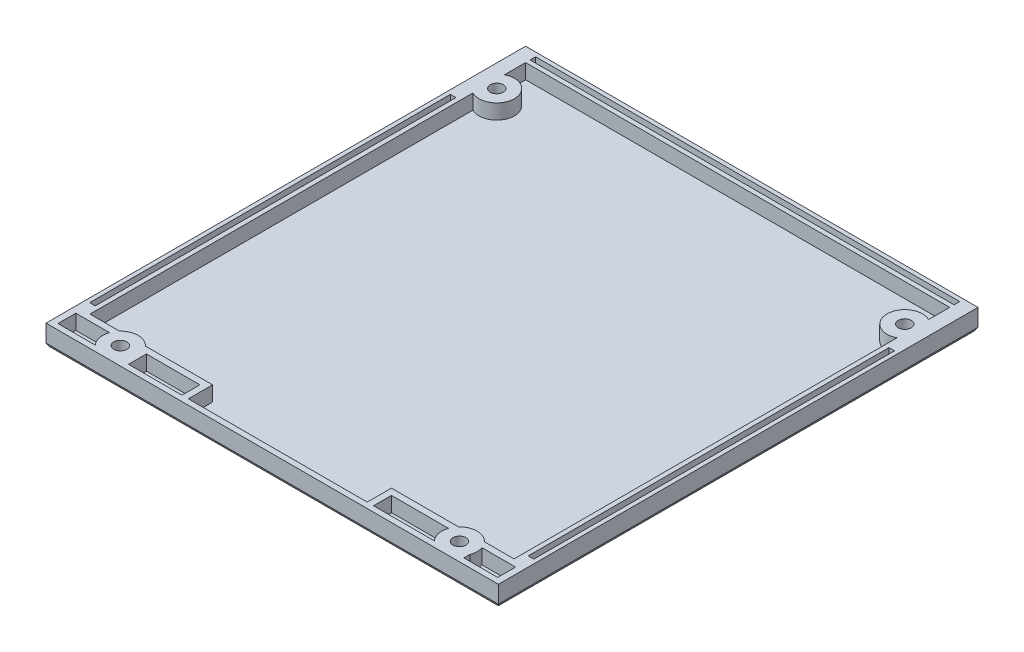
from build123d import *

# Parameters (mm, degrees)
SKETCH_1_W          = 121.4
SKETCH_1_H          = 128.7
EXTRUDE_1_DEPTH     = 1.5
EXTRUDE_2_DEPTH     = 2
SKETCH_3_W          = 1.5
SKETCH_3_H          = 96.8
SKETCH_3_W_2        = 113.8
SKETCH_3_H_2        = 1.5
EXTRUDE_3_DEPTH     = 2
SKETCH_5_W          = 121.4
SKETCH_5_H          = 8
SKETCH_5_W_2        = 12.45
SKETCH_5_H_2        = 4.8
SKETCH_5_W_3        = 9.05
SKETCH_5_W_4        = 17.75
SKETCH_5_W_5        = 14.35
SKETCH_5_W_6        = 48
EXTRUDE_5_DEPTH     = 4
SKETCH_7_R          = 4.75
EXTRUDE_10_DEPTH    = 4
SKETCH_8_R          = 1.75
CUT_EXTRUDE_3_DEPTH = 5.5
CHAMFER_1_SIZE      = 1.6
SKETCH_10_W         = 48
SKETCH_10_H         = 6.5
CUT_EXTRUDE_4_DEPTH = 4
CHAMFER_2_SIZE      = 0.5
CHAMFER_2_SIZE2     = 0.866025404


with BuildPart() as part:
    # Эскиз1 → Бобышка-Вытянуть1 (new body)
    with BuildSketch(Plane(origin=(0, 0, 0), x_dir=(1, 0, 0), z_dir=(0, 1, 0))):
        with Locations((60.7, 64.35)):
            Rectangle(SKETCH_1_W, SKETCH_1_H)
    extrude(amount=EXTRUDE_1_DEPTH)

    # Эскиз2 → Бобышка-Вытянуть2 (add)
    with BuildSketch(Plane(origin=(0, 1.5, 0), x_dir=(1, 0, 0), z_dir=(0, 1, 0))):
        Polygon((0, 8), (0, 128.7), (121.4, 128.7), (121.4, 8), (117.6, 8), (117.6, 124.9), (3.8, 124.9), (3.8, 8), align=None)
    extrude(amount=EXTRUDE_2_DEPTH)

    # Эскиз3 → Бобышка-Вытянуть3 (add)
    with BuildSketch(Plane(origin=(0, 3.5, 0), x_dir=(1, 0, 0), z_dir=(0, 1, 0))):
        Polygon((0, 8), (3.8, 8), (3.8, 124.9), (117.6, 124.9), (117.6, 8), (121.4, 8), (121.4, 128.7), (0, 128.7), align=None)
        with Locations((1.85, 59)):
            Rectangle(SKETCH_3_W, SKETCH_3_H, mode=Mode.SUBTRACT)
        with Locations((60.7, 126.85)):
            Rectangle(SKETCH_3_W_2, SKETCH_3_H_2, mode=Mode.SUBTRACT)
        with Locations((119.55, 59)):
            Rectangle(SKETCH_3_W, SKETCH_3_H, mode=Mode.SUBTRACT)
    extrude(amount=EXTRUDE_3_DEPTH)

    # Эскиз5 → Бобышка-Вытянуть5 (add)
    with BuildSketch(Plane(origin=(0, 1.5, 0), x_dir=(1, 0, 0), z_dir=(0, 1, 0))):
        with Locations((60.7, 4)):
            Rectangle(SKETCH_5_W, SKETCH_5_H)
        with Locations((7.925, 3.9)):
            Rectangle(SKETCH_5_W_2, SKETCH_5_H_2, mode=Mode.SUBTRACT)
        with Locations((115.175, 3.9)):
            Rectangle(SKETCH_5_W_3, SKETCH_5_H_2, mode=Mode.SUBTRACT)
        with Locations((95.275, 3.9)):
            Rectangle(SKETCH_5_W_4, SKETCH_5_H_2, mode=Mode.SUBTRACT)
        with Locations((27.825, 3.9)):
            Rectangle(SKETCH_5_W_5, SKETCH_5_H_2, mode=Mode.SUBTRACT)
        with Locations((60.7, 3.9)):
            Rectangle(SKETCH_5_W_6, SKETCH_5_H_2, mode=Mode.SUBTRACT)
    extrude(amount=EXTRUDE_5_DEPTH)

    # Эскиз7 → Бобышка-Вытянуть10 (add)
    with BuildSketch(Plane(origin=(0, 1.5, 0), x_dir=(1, 0, 0), z_dir=(0, 1, 0))):
        with Locations((5.95, 115)):
            Circle(SKETCH_7_R)
        with Locations((115.45, 115)):
            Circle(SKETCH_7_R)
        with Locations((15.2, 4.75)):
            Circle(SKETCH_7_R)
        with Locations((106.2, 4.75)):
            Circle(SKETCH_7_R)
    extrude(amount=EXTRUDE_10_DEPTH)

    # Эскиз8 → Вырез-Вытянуть3 (cut)
    with BuildSketch(Plane.XZ):
        with Locations(Location((15.2, -4.75, 0), (0, 0, 270))):
            Circle(SKETCH_8_R)
        with Locations(Location((106.2, -4.75, 0), (0, 0, 270))):
            Circle(SKETCH_8_R)
        with Locations(Location((5.95, -115, 0), (0, 0, 270))):
            Circle(SKETCH_8_R)
        with Locations(Location((115.45, -115, 0), (0, 0, 270))):
            Circle(SKETCH_8_R)
    extrude(amount=-CUT_EXTRUDE_3_DEPTH, mode=Mode.SUBTRACT)

    # Фаска1
    chamfer_1_edges = [part.edges().sort_by_distance(p)[0] for p in [
        (115.45, 0, -113.25),
        (5.95, 0, -113.25),
        (106.2, 0, -3),
        (15.2, 0, -3),
    ]]
    chamfer(chamfer_1_edges, length=CHAMFER_1_SIZE)

    # Эскиз10 → Вырез-Вытянуть4 (cut)
    with BuildSketch(Plane(origin=(0, 5.5, 0), x_dir=(1, 0, 0), z_dir=(0, 1, 0))):
        with Locations((60.7, 4.75)):
            Rectangle(SKETCH_10_W, SKETCH_10_H)
    extrude(amount=-CUT_EXTRUDE_4_DEPTH, mode=Mode.SUBTRACT)

    # Фаска2
    chamfer_2_edges = [part.edges().sort_by_distance(p)[0] for p in [
        (0, 0, -64.35),
        (60.7, 0, -128.7),
        (121.4, 0, -64.35),
        (60.7, 0, 0),
    ]]
    chamfer_2_side = [part.faces().sort_by_distance(p)[0] for p in [
        (60.7, 0, -64.390759898),
    ]]
    chamfer(chamfer_2_edges, length=CHAMFER_2_SIZE, length2=CHAMFER_2_SIZE2, reference=chamfer_2_side[0])


solid = part.part
